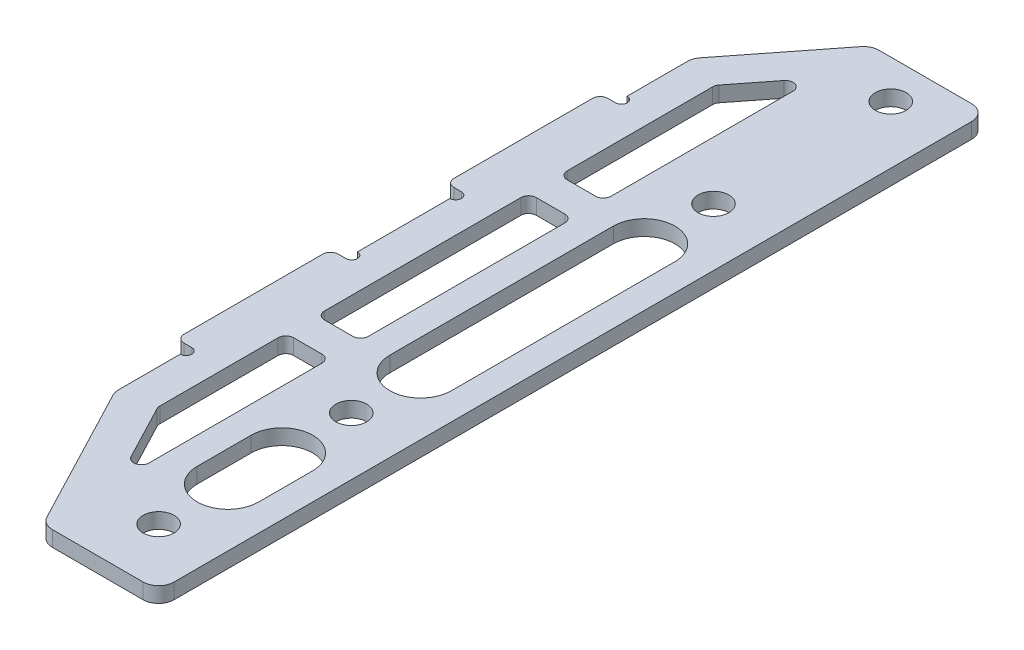
from build123d import *

# Parameters (mm, degrees)
SKETCH_1_R          = 2
EXTRUDE_1_DEPTH     = 2
SKETCH_2_R          = 0.75
CUT_EXTRUDE_1_DEPTH = 102.941600929
FILLET_1_R          = 2
SKETCH_3_W          = 5.7
SKETCH_3_H          = 27.500414906
CUT_EXTRUDE_2_DEPTH = 102.941600929
FILLET_2_R          = 1


with BuildPart() as part:
    # 草图1 → 凸台-拉伸1 (new body)
    with BuildSketch(Plane(origin=(0, 0, 0), x_dir=(1, 0, 0), z_dir=(0, 1, 0))):
        Polygon((7.5, 100), (7.5, -7.5), (-7.5, -7.5), (-17.7, 12), (-17.7, 22), (-19.7, 22), (-19.7, 42), (-17.7, 42), (-17.7, 57), (-19.7, 57), (-19.7, 77), (-17.7, 77), (-17.7, 87), (-7.5, 100), align=None)
        with Locations(Location((0, 25, 0), (0, 0, 270))):
            Circle(SKETCH_1_R, mode=Mode.SUBTRACT)
        with Locations(Location((0, 0, 0), (0, 0, 270))):
            Circle(SKETCH_1_R, mode=Mode.SUBTRACT)
        with Locations(Location((0, 72, 0), (0, 0, 270))):
            Circle(SKETCH_1_R, mode=Mode.SUBTRACT)
        with Locations(Location((0, 95, 0), (0, 0, 270))):
            Circle(SKETCH_1_R, mode=Mode.SUBTRACT)
    extrude(amount=EXTRUDE_1_DEPTH)

    # 草图2 → 切除-拉伸1 (cut, through all)
    with BuildSketch(Plane(origin=(0, 2, 0), x_dir=(1, 0, 0), z_dir=(0, 1, 0))):
        with Locations((-17.7, 77.75)):
            Circle(SKETCH_2_R)
        with Locations((-17.7, 56.25)):
            Circle(SKETCH_2_R)
        with Locations((-17.7, 42.75)):
            Circle(SKETCH_2_R)
        with Locations((-17.7, 21.25)):
            Circle(SKETCH_2_R)
    extrude(amount=-CUT_EXTRUDE_1_DEPTH, mode=Mode.SUBTRACT)

    # 圆角1
    fillet_1_edges = [part.edges().sort_by_distance(p)[0] for p in [
        (-17.7, 1, -87),
        (-7.5, 1, -100),
        (7.5, 1, -100),
        (7.5, 1, 7.5),
        (-7.5, 1, 7.5),
        (-17.7, 1, -12),
    ]]
    fillet(fillet_1_edges, radius=FILLET_1_R)

    # 草图3 → 切除-拉伸2 (cut, through all)
    with BuildSketch(Plane(origin=(0, 2, 0), x_dir=(1, 0, 0), z_dir=(0, 1, 0))):
        with BuildLine():
            Line((-4, 9), (-4, 16))
            ThreePointArc((-4, 16), (0, 20), (4, 16))
            Line((4, 16), (4, 9))
            ThreePointArc((4, 9), (0, 5), (-4, 9))
        make_face()
        with BuildLine():
            Line((4, 63), (4, 34))
            ThreePointArc((4, 34), (0, 30), (-4, 34))
            Line((-4, 34), (-4, 63))
            ThreePointArc((-4, 63), (0, 67), (4, 63))
        make_face()
        Polygon((-7.5, 92.710034389), (-13.2, 85.445328506), (-13.2, 65.209619483), (-7.5, 65.209619483), align=None)
        Polygon((-13.2, 13.105848495), (-7.5, 2.208789672), (-7.5, 29.709204577), (-13.2, 29.709204577), align=None)
        with Locations((-10.35, 47.45941203)):
            Rectangle(SKETCH_3_W, SKETCH_3_H)
    extrude(amount=-CUT_EXTRUDE_2_DEPTH, mode=Mode.SUBTRACT)

    # 圆角2
    fillet_2_edges = [part.edges().sort_by_distance(p)[0] for p in [
        (-7.5, 1, -92.710034389),
        (-7.5, 1, -65.209619483),
        (-13.2, 1, -65.209619483),
        (-13.2, 1, -85.445328506),
        (-7.5, 1, -29.709204577),
        (-7.5, 1, -2.208789672),
        (-13.2, 1, -13.105848495),
        (-13.2, 1, -29.709204577),
        (-13.2, 1, -33.709204577),
        (-13.2, 1, -61.209619483),
        (-7.5, 1, -61.209619483),
        (-7.5, 1, -33.709204577),
        (-19.7, 1, -22),
        (-19.7, 1, -42),
        (-19.7, 1, -57),
        (-19.7, 1, -77),
    ]]
    fillet(fillet_2_edges, radius=FILLET_2_R)


solid = part.part
